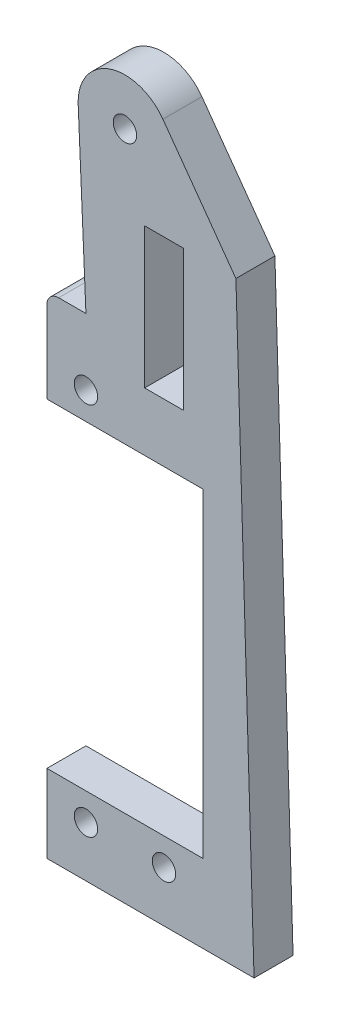
from build123d import *

# Parameters (mm, degrees)
ESQUISSE1_R        = 1.5
ESQUISSE1_W        = 5
ESQUISSE1_H        = 18
BOSS_EXTRU_1_DEPTH = 5
CONG_3_R           = 1.5


with BuildPart() as part:
    # Esquisse1 → Boss.-Extru.1 (new body)
    with BuildSketch(Plane.XY):
        with BuildLine():
            Line((0, 10), (0, 0))
            Line((0, 0), (26.554131445, 0))
            Line((26.554131445, 0), (24.226405413, 76.5))
            Line((24.226405413, 76.5), (14.870448313, 89.504102342))
            ThreePointArc((14.870448313, 89.504102342), (8.034842814, 91.669052587), (4.005728082, 85.7378852))
            Line((4.005728082, 85.7378852), (5, 63))
            Line((5, 63), (0, 63))
            Line((0, 63), (0, 51))
            Line((0, 51), (11, 51))
            Line((11, 51), (20, 51))
            Line((20, 51), (20, 10))
            Line((20, 10), (11, 10))
            Line((11, 10), (0, 10))
        make_face()
        with Locations((5, 54.5)):
            Circle(ESQUISSE1_R, mode=Mode.SUBTRACT)
        with Locations((15, 6.5)):
            Circle(ESQUISSE1_R, mode=Mode.SUBTRACT)
        with Locations((5, 6.5)):
            Circle(ESQUISSE1_R, mode=Mode.SUBTRACT)
        with Locations((10, 86)):
            Circle(ESQUISSE1_R, mode=Mode.SUBTRACT)
        with Locations((15.02885683, 67.5)):
            Rectangle(ESQUISSE1_W, ESQUISSE1_H, mode=Mode.SUBTRACT)
    extrude(amount=BOSS_EXTRU_1_DEPTH)

    # Congé3
    cong_3_edges = [part.edges().sort_by_distance(p)[0] for p in [
        (0, 63, 2.5),
    ]]
    fillet(cong_3_edges, radius=CONG_3_R)


solid = part.part
